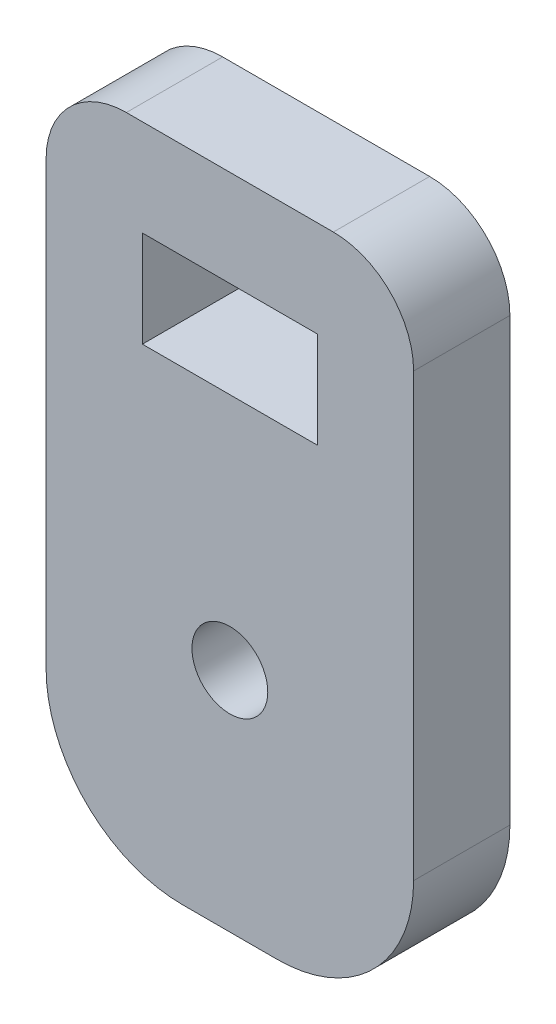
from build123d import *

# Parameters (mm, degrees)
SKETCH1_W           = 58.166
SKETCH1_H           = 104.14
BOSS_EXTRUDE1_DEPTH = 15.24
SKETCH2_W           = 27.686
SKETCH2_H           = 15.24
CUT_EXTRUDE1_DEPTH  = 121.252570684
SKETCH7_R           = 6
CUT_EXTRUDE2_DEPTH  = 121.252570684
FILLET1_R           = 21.59
FILLET2_R           = 12.7


with BuildPart() as part:
    # Sketch1 → Boss-Extrude1 (new body)
    with BuildSketch(Plane.XY):
        with Locations((29.083, 52.07)):
            Rectangle(SKETCH1_W, SKETCH1_H)
    extrude(amount=BOSS_EXTRUDE1_DEPTH)

    # Sketch2 → Cut-Extrude1 (cut, through all)
    with BuildSketch(Plane.XY.offset(15.24)):
        with Locations((29.083, 81.28)):
            Rectangle(SKETCH2_W, SKETCH2_H)
    extrude(amount=-CUT_EXTRUDE1_DEPTH, mode=Mode.SUBTRACT)

    # Sketch7 → Cut-Extrude2 (cut, through all)
    with BuildSketch(Plane.XY.offset(15.24)):
        with Locations((29.083, 35.9)):
            Circle(SKETCH7_R)
    extrude(amount=-CUT_EXTRUDE2_DEPTH, mode=Mode.SUBTRACT)

    # Fillet1
    fillet1_edges = [part.edges().sort_by_distance(p)[0] for p in [
        (58.166, 0, 7.62),
        (0, 0, 7.62),
    ]]
    fillet(fillet1_edges, radius=FILLET1_R)

    # Fillet2
    fillet2_edges = [part.edges().sort_by_distance(p)[0] for p in [
        (0, 104.14, 7.62),
        (58.166, 104.14, 7.62),
    ]]
    fillet(fillet2_edges, radius=FILLET2_R)


solid = part.part
